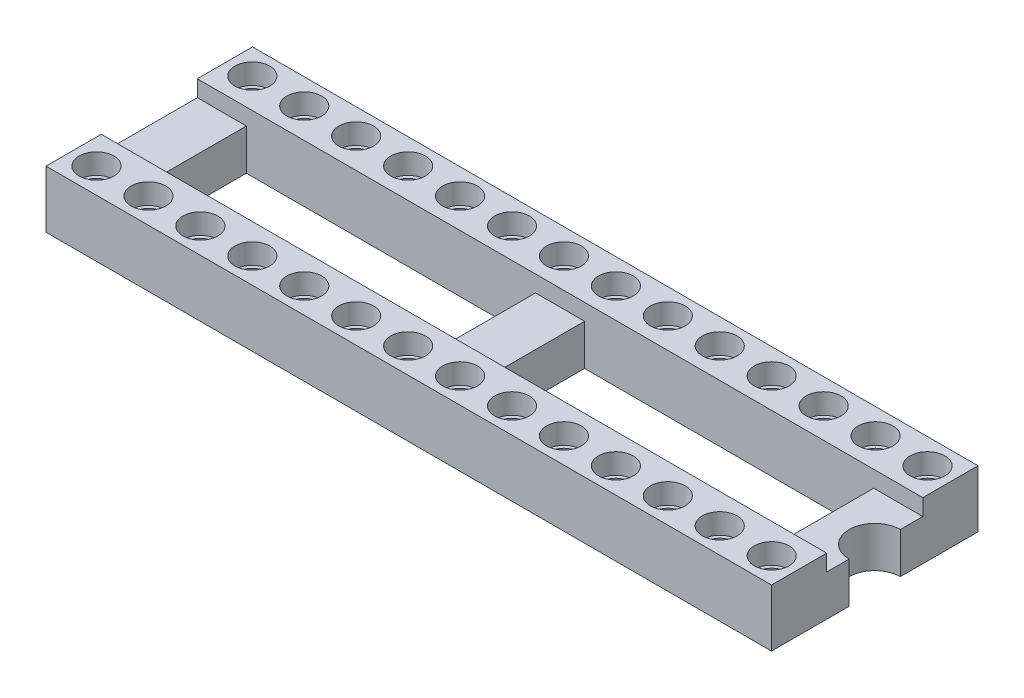
from build123d import *

# Parameters (mm, degrees)
SKETCH1_W                               = 2.7
SKETCH1_H                               = 2
SKETCH1_H_2                             = 0.8
SKETCH1_W_2                             = 4.7
BOSS_EXTRUDE1_DEPTH                     = 17.74
SKETCH2_R                               = 1.25
SKETCH2_W                               = 14.14
SKETCH2_H                               = 4.7
CUT_EXTRUDE1_DEPTH                      = 19.552900043
CBORE_FOR_M5_HEX_HEAD_BOLT2_D           = 1.35
CBORE_FOR_M5_HEX_HEAD_BOLT2_CBORE_D     = 1.7
CBORE_FOR_M5_HEX_HEAD_BOLT2_CBORE_DEPTH = 1
LPATTERN1_COUNT                         = 14
LPATTERN1_PITCH                         = 2.54
LPATTERN1_COUNT_DIR2                    = 2
LPATTERN1_PITCH_DIR2                    = 7.62


with BuildPart() as part:
    # Sketch1 → Boss-Extrude1 (new, symmetric)
    with BuildSketch(Plane(origin=(0, 0, 0), x_dir=(0, 0, -1), z_dir=(1, 0, 0))):
        with Locations((-3.7, 1)):
            Rectangle(SKETCH1_W, SKETCH1_H)
        with Locations((-3.7, 2.4)):
            Rectangle(SKETCH1_W, SKETCH1_H_2)
        with Locations((0, 1)):
            Rectangle(SKETCH1_W_2, SKETCH1_H)
        with Locations((3.7, 1)):
            Rectangle(SKETCH1_W, SKETCH1_H)
        with Locations((3.7, 2.4)):
            Rectangle(SKETCH1_W, SKETCH1_H_2)
    extrude(amount=BOSS_EXTRUDE1_DEPTH, both=True)

    # Sketch2 → Cut-Extrude1 (cut, through all)
    with BuildSketch(Plane(origin=(0, 2, 0), x_dir=(1, 0, 0), z_dir=(0, 1, 0))):
        with Locations((17.74, 0)):
            Circle(SKETCH2_R)
        with Locations((-8.27, 0)):
            Rectangle(SKETCH2_W, SKETCH2_H)
        with Locations((8.27, 0)):
            Rectangle(SKETCH2_W, SKETCH2_H)
    extrude(amount=-CUT_EXTRUDE1_DEPTH, mode=Mode.SUBTRACT)

    # CBORE for M5 Hex Head Bolt2 (through all)
    with Locations(Plane(origin=(0, 2.8, 0), x_dir=(1, 0, 0), z_dir=(0, 1, 0))):
        with Locations((16.51, 3.81)):
            cbore_for_m5_hex_head_bolt2 = CounterBoreHole(CBORE_FOR_M5_HEX_HEAD_BOLT2_D / 2, CBORE_FOR_M5_HEX_HEAD_BOLT2_CBORE_D / 2, CBORE_FOR_M5_HEX_HEAD_BOLT2_CBORE_DEPTH)

    # LPattern1: CBORE for M5 Hex Head Bolt2 14 × 2
    with Locations(*[(-i * LPATTERN1_PITCH, 0, j * LPATTERN1_PITCH_DIR2) for i in range(LPATTERN1_COUNT) for j in range(LPATTERN1_COUNT_DIR2) if (i, j) != (0, 0)]):
        add(cbore_for_m5_hex_head_bolt2, mode=Mode.SUBTRACT)


solid = part.part
